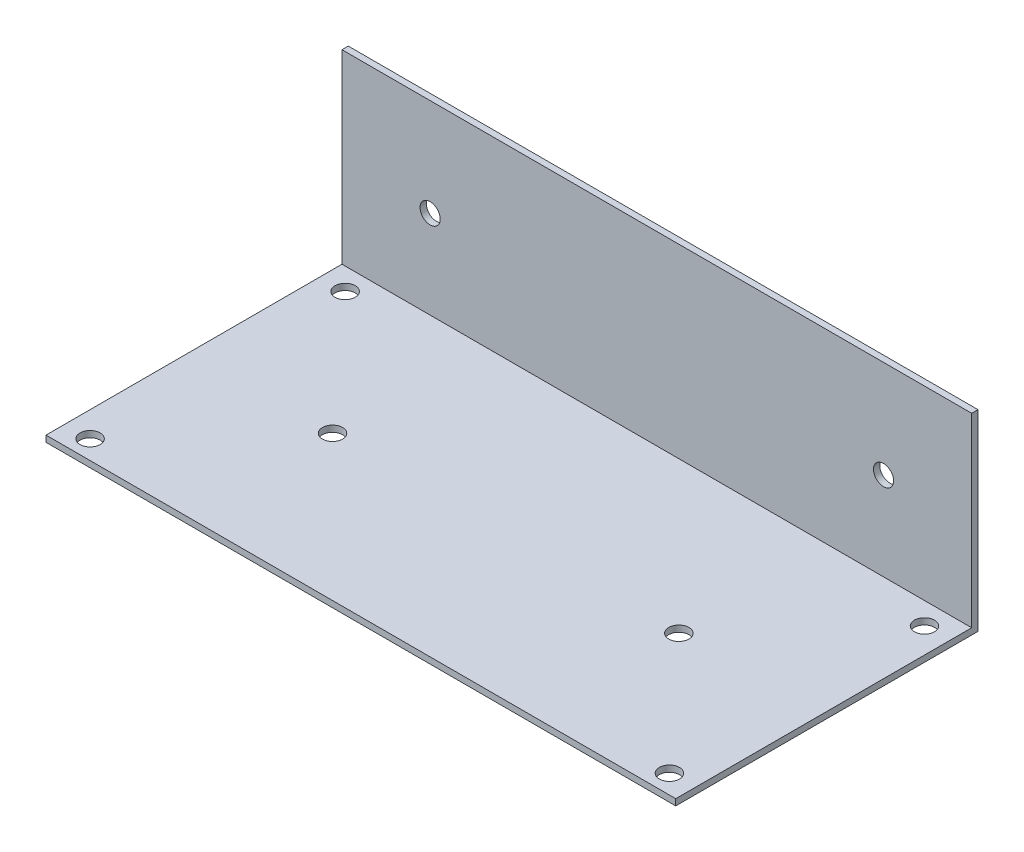
from build123d import *

# Parameters (mm, degrees)
EXTRUDE_1_DEPTH     = 100
SKETCH_2_R          = 1.6
CUT_EXTRUDE_1_DEPTH = 1
SKETCH_3_R          = 1.6
CUT_EXTRUDE_2_DEPTH = 1
SKETCH1_R           = 1.6
CUT_EXTRUDE1_DEPTH  = 10


with BuildPart() as part:
    # Эскиз1 → Бобышка-Вытянуть1 (new body)
    with BuildSketch(Plane(origin=(0, 0, 0), x_dir=(0, 0, -1), z_dir=(1, 0, 0))):
        Polygon((0, 0), (-48, 0), (-48, 1), (-1, 1), (-1, 30.5), (0, 30.5), align=None)
    extrude(amount=EXTRUDE_1_DEPTH)

    # Эскиз2 → Вырез-Вытянуть1 (cut)
    with BuildSketch(Plane(origin=(0, 0, 0), x_dir=(-1, 0, 0), z_dir=(0, 0, -1))):
        with Locations((-86, 15)):
            Circle(SKETCH_2_R)
        with Locations((-14, 15)):
            Circle(SKETCH_2_R)
    extrude(amount=-CUT_EXTRUDE_1_DEPTH, mode=Mode.SUBTRACT)

    # Эскиз3 → Вырез-Вытянуть2 (cut)
    with BuildSketch(Plane.XZ):
        with Locations(Location((22.5, 25, 0), (0, 0, 270))):
            Circle(SKETCH_3_R)
        with Locations(Location((77.5, 25, 0), (0, 0, 270))):
            Circle(SKETCH_3_R)
    extrude(amount=-CUT_EXTRUDE_2_DEPTH, mode=Mode.SUBTRACT)

    # Sketch1 → Cut-Extrude1 (cut)
    with BuildSketch(Plane.XZ):
        with Locations(Location((4, 45, 0), (0, 0, 270))):
            Circle(SKETCH1_R)
        with Locations(Location((96, 45, 0), (0, 0, 270))):
            Circle(SKETCH1_R)
        with Locations(Location((96, 4.5, 0), (0, 0, 270))):
            Circle(SKETCH1_R)
        with Locations(Location((4, 4.5, 0), (0, 0, 270))):
            Circle(SKETCH1_R)
    extrude(amount=-CUT_EXTRUDE1_DEPTH, mode=Mode.SUBTRACT)


solid = part.part
